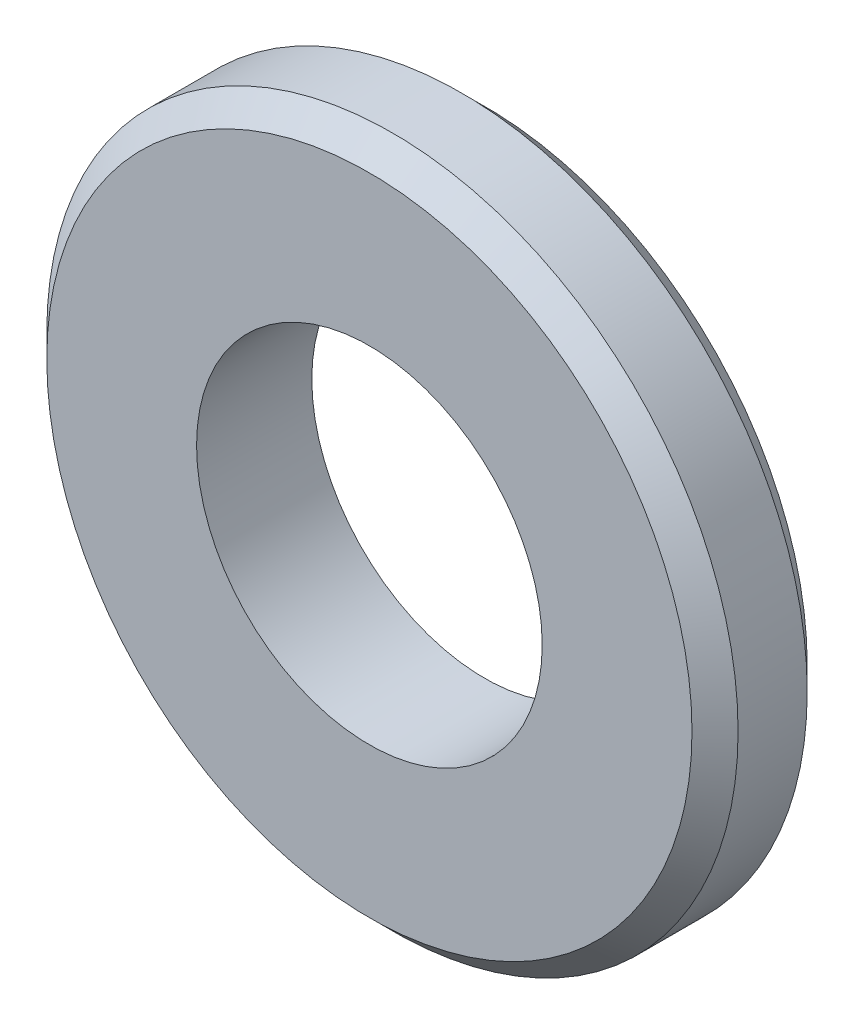
from build123d import *

# Parameters (mm, degrees)
SKETCH_1_R      = 3
SKETCH_1_R_2    = 1.5
EXTRUDE_1_DEPTH = 0.5
CHAMFER_1_SIZE  = 0.2


with BuildPart() as part:
    # 草图1 → 凸台-拉伸1 (new, symmetric)
    with BuildSketch(Plane.XY):
        Circle(SKETCH_1_R)
        Circle(SKETCH_1_R_2, mode=Mode.SUBTRACT)
    extrude(amount=EXTRUDE_1_DEPTH, both=True)

    # 倒角1
    chamfer_1_edges = [part.edges().sort_by_distance(p)[0] for p in [
        (-3, 0, -0.5),
        (-3, 0, 0.5),
    ]]
    chamfer(chamfer_1_edges, length=CHAMFER_1_SIZE)


solid = part.part
